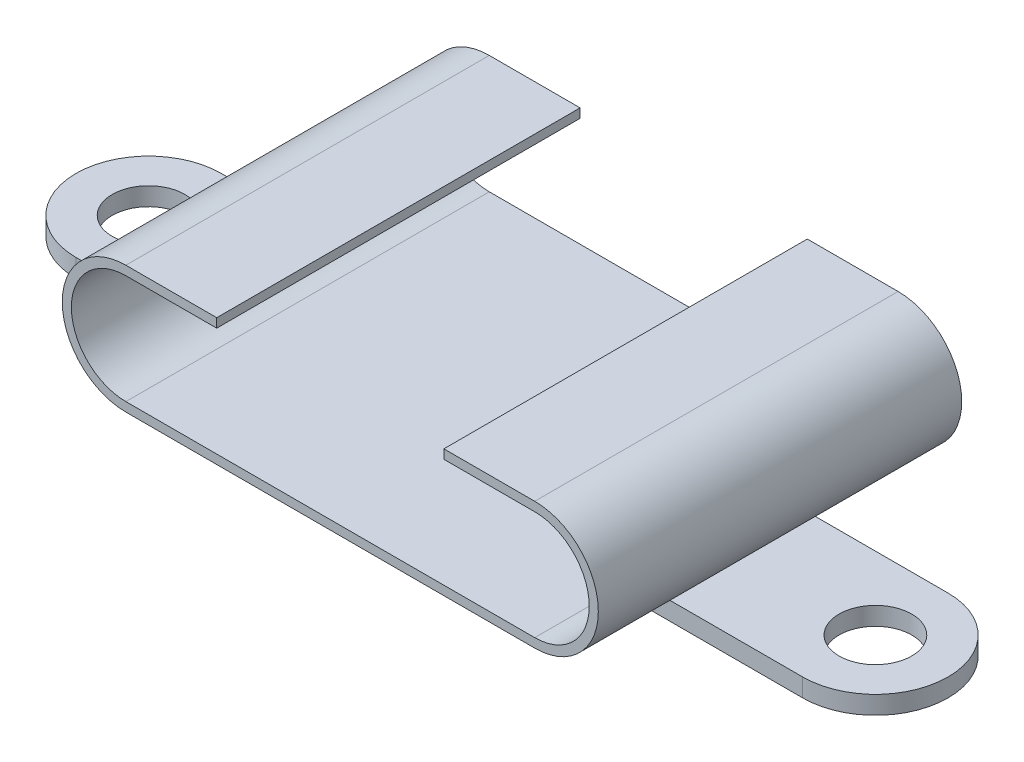
from build123d import *

# Parameters (mm, degrees)
BOSS_EXTRU_1_DEPTH      = 40
ENL_V_MAT_EXTRU_1_DEPTH = 66.977268813
ESQUISSE3_W             = 25.003743198
ESQUISSE3_H             = 40
ENL_V_MAT_EXTRU_2_DEPTH = 1
ESQUISSE4_R             = 4
BOSS_EXTRU_2_DEPTH      = 2


with BuildPart() as part:
    # Esquisse1 → Boss.-Extru.1 (new body)
    with BuildSketch(Plane.XY):
        with BuildLine():
            Line((0, 7), (45, 7))
            ThreePointArc((45, 7), (52, 0), (45, -7))
            Line((45, -7), (0, -7))
            ThreePointArc((0, -7), (-7, 0), (0, 7))
        make_face()
    extrude(amount=BOSS_EXTRU_1_DEPTH)

    # Esquisse2 → Enlèv. mat.-Extru.1 (cut, through all)
    with BuildSketch(Plane.XY.offset(40)):
        with BuildLine():
            Line((0, -6), (45, -6))
            ThreePointArc((45, -6), (51, 0), (45, 6))
            Line((45, 6), (0, 6))
            ThreePointArc((0, 6), (-6, 0), (0, -6))
        make_face()
    extrude(amount=-ENL_V_MAT_EXTRU_1_DEPTH, mode=Mode.SUBTRACT)

    # Esquisse3 → Enlèv. mat.-Extru.2 (cut)
    with BuildSketch(Plane(origin=(0, 7, 0), x_dir=(1, 0, 0), z_dir=(0, 1, 0))):
        with Locations((22.5, -20)):
            Rectangle(ESQUISSE3_W, ESQUISSE3_H)
    extrude(amount=-ENL_V_MAT_EXTRU_2_DEPTH, mode=Mode.SUBTRACT)

    # Esquisse4 → Boss.-Extru.2 (add)
    with BuildSketch(Plane(origin=(0, -7, 0), x_dir=(-1, 0, 0), z_dir=(0, -1, 0))):
        with BuildLine():
            Line((-62.5, -12), (17.5, -12))
            ThreePointArc((17.5, -12), (25.5, -20), (17.5, -28))
            Line((17.5, -28), (-62.5, -28))
            ThreePointArc((-62.5, -28), (-70.5, -20), (-62.5, -12))
        make_face()
        with Locations(Location((17.5, -20, 0), (0, 0, 90))):
            Circle(ESQUISSE4_R, mode=Mode.SUBTRACT)
        with Locations(Location((-62.5, -20, 0), (0, 0, 270))):
            Circle(ESQUISSE4_R, mode=Mode.SUBTRACT)
    extrude(amount=BOSS_EXTRU_2_DEPTH)


solid = part.part
